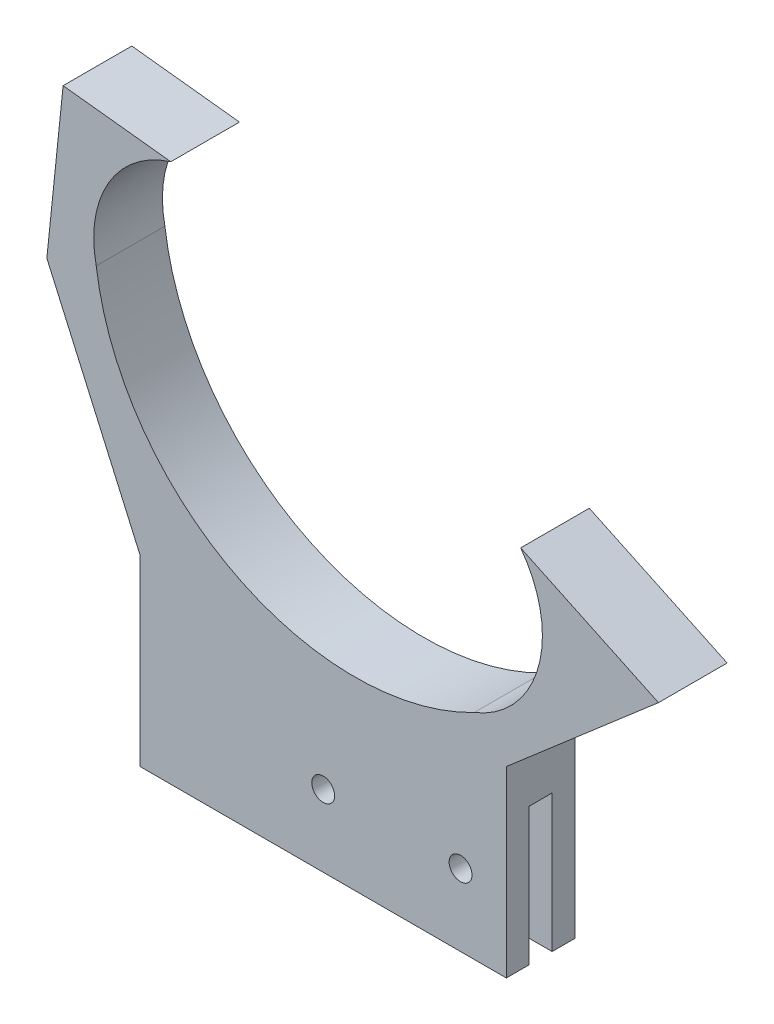
from build123d import *

# Parameters (mm, degrees)
SKETCH7_W           = 50.8
SKETCH7_H           = 19.05
SKETCH7_R           = 1.5875
BOSS_EXTRUDE1_DEPTH = 4.7625
SKETCH7_6_W         = 50.8
SKETCH7_6_H         = 19.05
CUT_EXTRUDE1_DEPTH  = 1.5875
SKETCH13_W          = 50.8
SKETCH13_H          = 6.35
BOSS_EXTRUDE4_DEPTH = 9.525
BOSS_EXTRUDE5_DEPTH = 9.525


with BuildPart() as part:
    # Sketch7 → Boss-Extrude1 (new, symmetric)
    with BuildSketch(Plane.XY):
        with Locations((25.4, 9.525)):
            Rectangle(SKETCH7_W, SKETCH7_H)
        with Locations((25.4, 9.975665903)):
            Circle(SKETCH7_R, mode=Mode.SUBTRACT)
        with Locations((44.45, 9.975665903)):
            Circle(SKETCH7_R, mode=Mode.SUBTRACT)
    extrude(amount=BOSS_EXTRUDE1_DEPTH, both=True)

    # Sketch7<6> → Cut-Extrude1 (cut, symmetric)
    with BuildSketch(Plane.XY):
        with Locations((25.4, 9.525)):
            Rectangle(SKETCH7_6_W, SKETCH7_6_H)
    extrude(amount=CUT_EXTRUDE1_DEPTH, both=True, mode=Mode.SUBTRACT)


with BuildPart() as cut_extrude1_piece_1:
    # of the separate pieces the step leaves, piece 1, a body of its own (cut_extrude1_pieces)
    add(part.part.solids().sort_by_distance((0, 0, 4.7625))[0])



with BuildPart() as cut_extrude1_piece_2:
    # of the separate pieces the step leaves, piece 2, a body of its own (cut_extrude1_pieces)
    add(part.part.solids().sort_by_distance((0, 0, -1.5875))[0])


with BuildPart() as cut_extrude1_piece_1_1:
    add(cut_extrude1_piece_1.part)

    add(cut_extrude1_piece_2.part)  # Boss-Extrude4 merges Cut-Extrude1 piece 2
    # Sketch13 → Boss-Extrude4 (add)
    with BuildSketch(Plane.XY.offset(4.7625)):
        with Locations((25.4, 22.225)):
            Rectangle(SKETCH13_W, SKETCH13_H)
    extrude(amount=-BOSS_EXTRUDE4_DEPTH)

    # Sketch14 → Boss-Extrude5 (add)
    with BuildSketch(Plane.XY.offset(4.7625)):
        with BuildLine():
            Line((50.8, 25.4), (71.902482506, 43.622575132))
            Line((71.902482506, 43.622575132), (52.787315523, 52.655864431))
            ThreePointArc((52.787315523, 52.655864431), (55.247905821, 39.572849469), (46.356867644, 29.664811055))
            ThreePointArc((46.356867644, 29.664811055), (13.014341519, 29.769386724), (-6.078550984, 57.104280913))
            ThreePointArc((-6.078550984, 57.104280913), (-4.350402215, 67.954625431), (4.26443102, 74.773798595))
            Line((4.26443102, 74.773798595), (-10.669308695, 76.446075822))
            Line((-10.669308695, 76.446075822), (-12.926576502, 54.593807627))
            Line((-12.926576502, 54.593807627), (0, 25.4))
            Line((0, 25.4), (50.8, 25.4))
        make_face()
    extrude(amount=-BOSS_EXTRUDE5_DEPTH)


solid = cut_extrude1_piece_1_1.part
